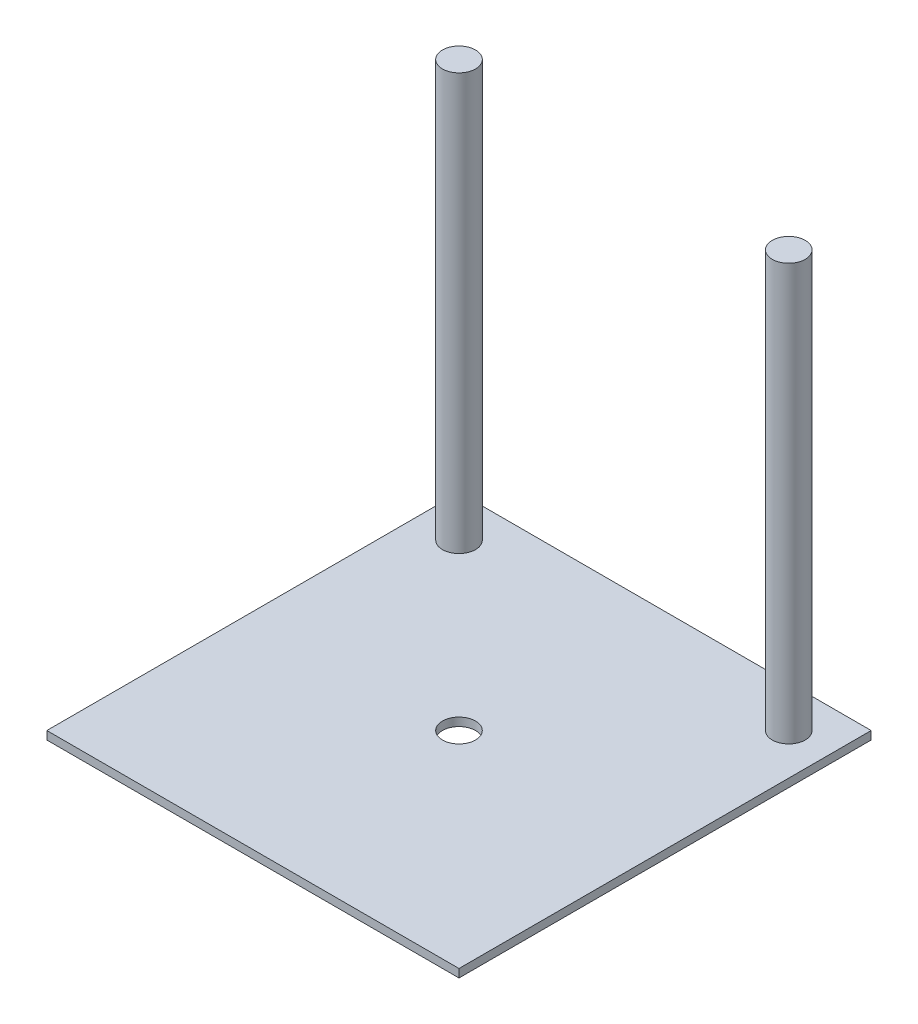
from build123d import *

# Parameters (mm, degrees)
SKETCH1_W           = 50
SKETCH1_H           = 50
SKETCH1_R           = 2
BOSS_EXTRUDE1_DEPTH = 1
SKETCH2_R           = 2
BOSS_EXTRUDE2_DEPTH = 70
CUT_EXTRUDE1_START  = -9.5
SKETCH7_R           = 2
CUT_EXTRUDE1_DEPTH  = 9.5
CUT_EXTRUDE2_START  = -10
SKETCH9_R           = 2
CUT_EXTRUDE2_DEPTH  = 10


with BuildPart() as part:
    # Sketch1 → Boss-Extrude1 (new body)
    with BuildSketch(Plane(origin=(0, 0, 0), x_dir=(1, 0, 0), z_dir=(0, 1, 0))):
        with Locations((25, 25)):
            Rectangle(SKETCH1_W, SKETCH1_H)
        with Locations(Location((25, 25, 0), (0, 0, 270))):
            Circle(SKETCH1_R, mode=Mode.SUBTRACT)
    extrude(amount=BOSS_EXTRUDE1_DEPTH)

    # Sketch2 → Boss-Extrude2 (add)
    with BuildSketch(Plane(origin=(0, 1, 0), x_dir=(1, 0, 0), z_dir=(0, 1, 0))):
        with Locations(Location((5, 45, 0), (0, 0, 90))):
            Circle(SKETCH2_R)
        with Locations(Location((45, 45, 0), (0, 0, 90))):
            Circle(SKETCH2_R)
    extrude(amount=BOSS_EXTRUDE2_DEPTH)

    # Sketch7 → Cut-Extrude1 (cut)
    with BuildSketch(Plane(origin=(0, 71, 0), x_dir=(1, 0, 0), z_dir=(0, 1, 0)).offset(CUT_EXTRUDE1_START)):
        with Locations(Location((5, 45, 0), (0, 0, 90))):
            Circle(SKETCH7_R)
        with Locations(Location((45, 45, 0), (0, 0, 90))):
            Circle(SKETCH7_R)
    extrude(amount=CUT_EXTRUDE1_DEPTH, mode=Mode.SUBTRACT)

    # Sketch9 → Cut-Extrude2 (cut)
    with BuildSketch(Plane(origin=(0, 61.5, 0), x_dir=(1, 0, 0), z_dir=(0, 1, 0)).offset(CUT_EXTRUDE2_START)):
        with Locations(Location((5, 45, 0), (0, 0, 90))):
            Circle(SKETCH9_R)
        with Locations(Location((45, 45, 0), (0, 0, 90))):
            Circle(SKETCH9_R)
    extrude(amount=CUT_EXTRUDE2_DEPTH, mode=Mode.SUBTRACT)


solid = part.part
